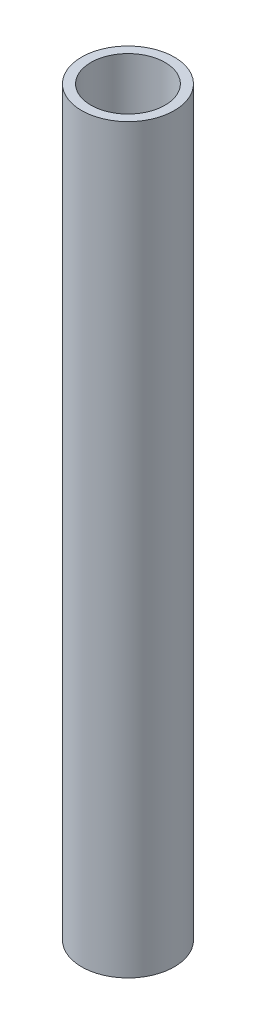
from build123d import *

# Parameters (mm, degrees)
SKETCH1_W          = 12.5
SKETCH1_H          = 200
SKETCH2_R          = 10
CUT_EXTRUDE1_DEPTH = 71.5


with BuildPart() as part:
    # Sketch1 → Revolve1 (revolve)
    with BuildSketch(Plane.XY, mode=Mode.PRIVATE) as revolve1_sk:
        with Locations((6.25, 100)):
            Rectangle(SKETCH1_W, SKETCH1_H)
    revolve(revolve1_sk.sketch.rotate(Axis((0, 200, 0), (0, -1, 0)), 180), axis=Axis((0, 200, 0), (0, -1, 0)))

    # Sketch2 → Cut-Extrude1 (cut)
    with BuildSketch(Plane(origin=(0, 200, 0), x_dir=(1, 0, 0), z_dir=(0, 1, 0))):
        with Locations(Location((0, 0, 0), (0, 0, 180))):
            Circle(SKETCH2_R)
    extrude(amount=-CUT_EXTRUDE1_DEPTH, mode=Mode.SUBTRACT)


solid = part.part
